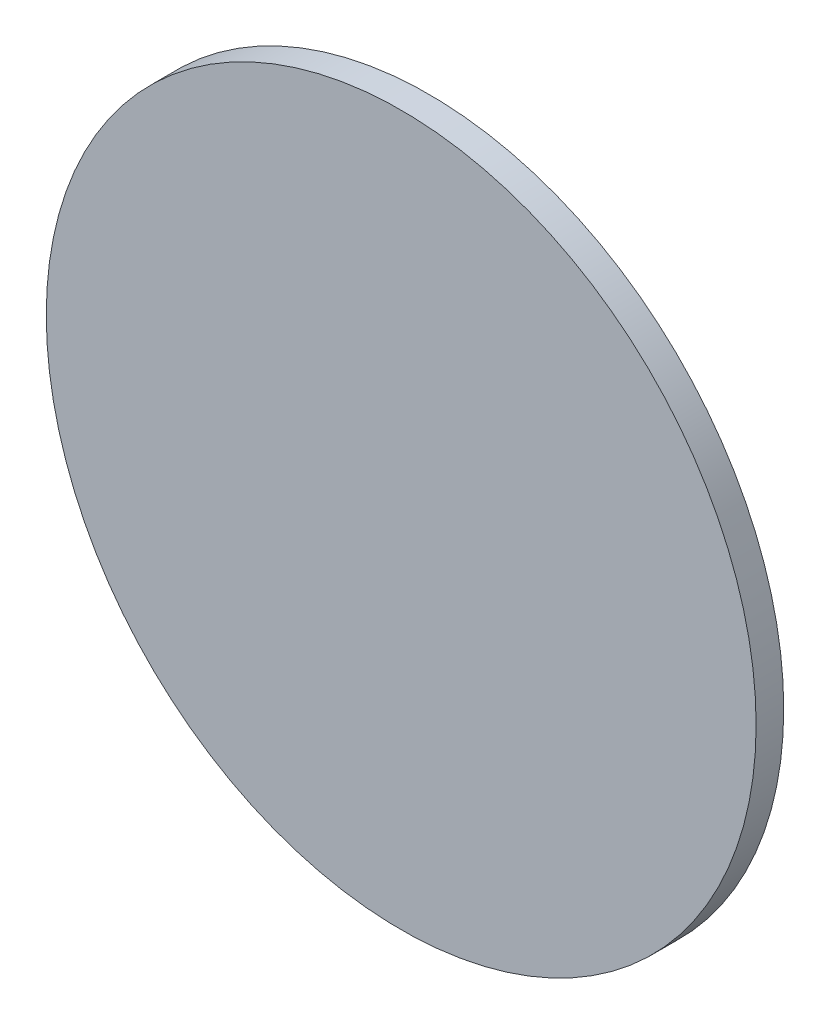
from build123d import *

# Parameters (mm, degrees)
CROQUIS1_R = 45
DISK_DEPTH = 3.5


with BuildPart() as part:
    # Croquis1 → Disk (new body)
    with BuildSketch(Plane.XY):
        Circle(CROQUIS1_R)
    extrude(amount=DISK_DEPTH)


solid = part.part
